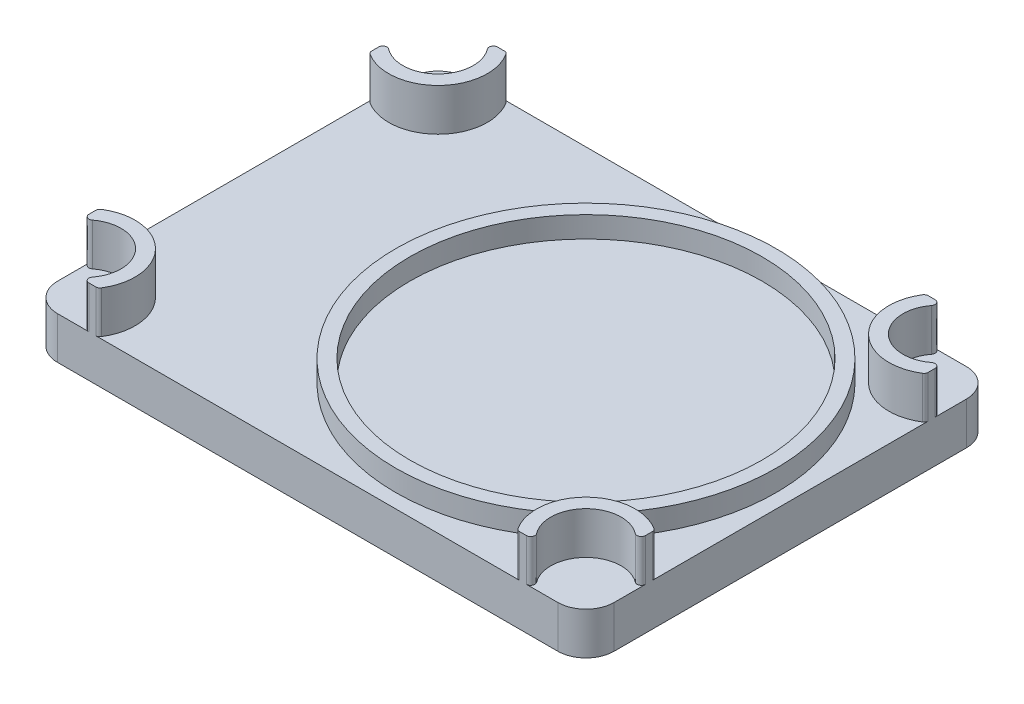
from build123d import *

# Parameters (mm, degrees)
SKETCH1_W           = 39.5
SKETCH1_H           = 29
BOSS_EXTRUDE1_DEPTH = 3
SKETCH2_R           = 13.5
SKETCH2_R_2         = 12.5
BOSS_EXTRUDE3_DEPTH = 1.5
BOSS_EXTRUDE4_DEPTH = 3
FILLET1_R           = 2
FILLET2_R           = 0.3


with BuildPart() as part:
    # Sketch1 → Boss-Extrude1 (new body)
    with BuildSketch(Plane(origin=(0, 0, 0), x_dir=(1, 0, 0), z_dir=(0, 1, 0))):
        with Locations((-109.95705295, -40.158748639)):
            Rectangle(SKETCH1_W, SKETCH1_H)
    extrude(amount=BOSS_EXTRUDE1_DEPTH)

    # Sketch2 → Boss-Extrude3 (add)
    with BuildSketch(Plane(origin=(0, 3, 0), x_dir=(1, 0, 0), z_dir=(0, 1, 0))):
        with Locations(Location((-104.70705295, -40.158748639, 0), (0, 0, 270))):
            Circle(SKETCH2_R)
        with Locations(Location((-104.70705295, -40.158748639, 0), (0, 0, 270))):
            Circle(SKETCH2_R_2, mode=Mode.SUBTRACT)
    extrude(amount=BOSS_EXTRUDE3_DEPTH)

    # Sketch3 → Boss-Extrude4 (add)
    with BuildSketch(Plane(origin=(0, 3, 0), x_dir=(1, 0, 0), z_dir=(0, 1, 0))):
        with BuildLine():
            Line((-124.834771627, -25.658748639), (-126.20705295, -25.658748639))
            ThreePointArc((-126.20705295, -25.658748639), (-125.939285997, -29.426515592), (-129.70705295, -29.158748639))
            Line((-129.70705295, -29.158748639), (-129.70705295, -30.531029962))
            ThreePointArc((-129.70705295, -30.531029962), (-125.232179216, -30.133622373), (-124.834771627, -25.658748639))
        make_face()
        with BuildLine():
            Line((-93.70705295, -25.658748639), (-95.079334273, -25.658748639))
            ThreePointArc((-95.079334273, -25.658748639), (-94.681926684, -30.133622373), (-90.20705295, -30.531029962))
            Line((-90.20705295, -30.531029962), (-90.20705295, -29.158748639))
            ThreePointArc((-90.20705295, -29.158748639), (-93.974819903, -29.426515592), (-93.70705295, -25.658748639))
        make_face()
        with BuildLine():
            ThreePointArc((-124.834771627, -54.658748639), (-125.232179216, -50.183874905), (-129.70705295, -49.786467316))
            Line((-129.70705295, -49.786467316), (-129.70705295, -51.158748639))
            ThreePointArc((-129.70705295, -51.158748639), (-125.939285997, -50.890981686), (-126.20705295, -54.658748639))
            Line((-126.20705295, -54.658748639), (-124.834771627, -54.658748639))
        make_face()
        with BuildLine():
            Line((-90.20705295, -51.158748639), (-90.20705295, -49.786467316))
            ThreePointArc((-90.20705295, -49.786467316), (-94.681926684, -50.183874905), (-95.079334273, -54.658748639))
            Line((-95.079334273, -54.658748639), (-93.70705295, -54.658748639))
            ThreePointArc((-93.70705295, -54.658748639), (-93.974819903, -50.890981686), (-90.20705295, -51.158748639))
        make_face()
    extrude(amount=BOSS_EXTRUDE4_DEPTH)

    # Fillet1
    fillet1_edges = [part.edges().sort_by_distance(p)[0] for p in [
        (-129.70705295, 1.5, 25.658748639),
        (-90.20705295, 1.5, 25.658748639),
        (-90.20705295, 1.5, 54.658748639),
        (-129.70705295, 1.5, 54.658748639),
    ]]
    fillet(fillet1_edges, radius=FILLET1_R)

    # Fillet2
    fillet2_edges = [part.edges().sort_by_distance(p)[0] for p in [
        (-93.70705295, 4.5, 54.658748639),
        (-90.20705295, 4.5, 51.158748639),
        (-90.20705295, 4.5, 49.786467316),
        (-95.079334273, 4.5, 54.658748639),
        (-126.20705295, 4.5, 54.658748639),
        (-124.834771627, 4.5, 54.658748639),
        (-129.70705295, 4.5, 49.786467316),
        (-129.70705295, 4.5, 51.158748639),
        (-93.70705295, 4.5, 25.658748639),
        (-95.079334273, 4.5, 25.658748639),
        (-90.20705295, 4.5, 30.531029962),
        (-90.20705295, 4.5, 29.158748639),
        (-129.70705295, 4.5, 29.158748639),
        (-129.70705295, 4.5, 30.531029962),
        (-124.834771627, 4.5, 25.658748639),
        (-126.20705295, 4.5, 25.658748639),
    ]]
    fillet(fillet2_edges, radius=FILLET2_R)


solid = part.part
